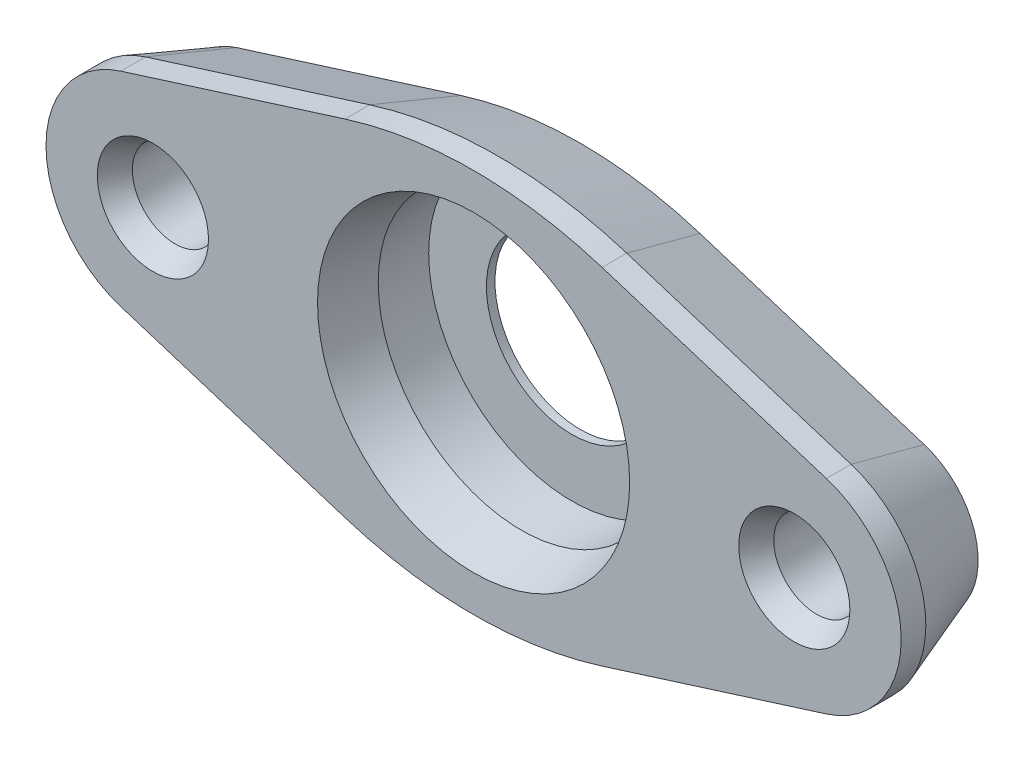
from build123d import *

# Parameters (mm, degrees)
SKETCH1_R           = 1
BOSS_EXTRUDE1_DEPTH = 2.5
SKETCH2_R           = 3.35
CUT_EXTRUDE1_DEPTH  = 2.3
CHAMFER1_SIZE       = 0.7
CHAMFER1_SIZE2      = 1.923234194
CHAMFER2_SIZE       = 0.3
CHAMFER2_SIZE2      = 1.119615242
CHAMFER3_SIZE       = 0.3
CHAMFER3_SIZE2      = 0.519615242
SKETCH3_R           = 2
CUT_EXTRUDE2_DEPTH  = 10


with BuildPart() as part:
    # Sketch1 → Boss-Extrude1 (new body)
    with BuildSketch(Plane.XY):
        with BuildLine():
            Line((-8.251445087, 2.384393064), (-3.005780347, 4.037572254))
            ThreePointArc((-3.005780347, 4.037572254), (0, 4.5), (3.005780347, 4.037572254))
            Line((3.005780347, 4.037572254), (8.251445087, 2.384393064))
            ThreePointArc((8.251445087, 2.384393064), (10, 0), (8.251445087, -2.384393064))
            Line((8.251445087, -2.384393064), (3.005780347, -4.037572254))
            ThreePointArc((3.005780347, -4.037572254), (0, -4.5), (-3.005780347, -4.037572254))
            Line((-3.005780347, -4.037572254), (-8.251445087, -2.384393064))
            ThreePointArc((-8.251445087, -2.384393064), (-10, 0), (-8.251445087, 2.384393064))
        make_face()
        with Locations((7.5, 0)):
            Circle(SKETCH1_R, mode=Mode.SUBTRACT)
        with Locations((-7.5, 0)):
            Circle(SKETCH1_R, mode=Mode.SUBTRACT)
    extrude(amount=BOSS_EXTRUDE1_DEPTH)

    # Sketch2 → Cut-Extrude1 (cut)
    with BuildSketch(Plane.XY.offset(2.5)):
        Circle(SKETCH2_R)
    extrude(amount=-CUT_EXTRUDE1_DEPTH, mode=Mode.SUBTRACT)

    # Chamfer1
    chamfer1_edges = [part.edges().sort_by_distance(p)[0] for p in [
        (-5.628612717, -3.210982659, 0),
        (-10, 0, 0),
        (-5.628612717, 3.210982659, 0),
        (0, 4.5, 0),
        (5.628612717, 3.210982659, 0),
        (10, 0, 0),
        (5.628612717, -3.210982659, 0),
        (0, -4.5, 0),
    ]]
    chamfer1_side = [part.faces().sort_by_distance(p)[0] for p in [
        (0, 0, 0),
    ]]
    chamfer(chamfer1_edges, length=CHAMFER1_SIZE, length2=CHAMFER1_SIZE2, reference=chamfer1_side[0])

    # Chamfer2
    chamfer2_edges = [part.edges().sort_by_distance(p)[0] for p in [
        (-3.35, 0, 2.5),
    ]]
    chamfer2_side = [part.faces().sort_by_distance(p)[0] for p in [
        (-5.562690807, -3.001807369, 2.5),
    ]]
    chamfer(chamfer2_edges, length=CHAMFER2_SIZE, length2=CHAMFER2_SIZE2, reference=chamfer2_side[0])

    # Chamfer3
    chamfer3_edges = [part.edges().sort_by_distance(p)[0] for p in [
        (6.5, 0, 2.5),
        (-8.5, 0, 2.5),
    ]]
    chamfer3_side = [part.faces().sort_by_distance(p)[0] for p in [
        (-3.869317122, 0, 2.5),
    ]]
    chamfer(chamfer3_edges, length=CHAMFER3_SIZE, length2=CHAMFER3_SIZE2, reference=chamfer3_side[0])

    # Sketch3 → Cut-Extrude2 (cut)
    with BuildSketch(Plane.XY.offset(0.2)):
        Circle(SKETCH3_R)
    extrude(amount=-CUT_EXTRUDE2_DEPTH, mode=Mode.SUBTRACT)


solid = part.part
